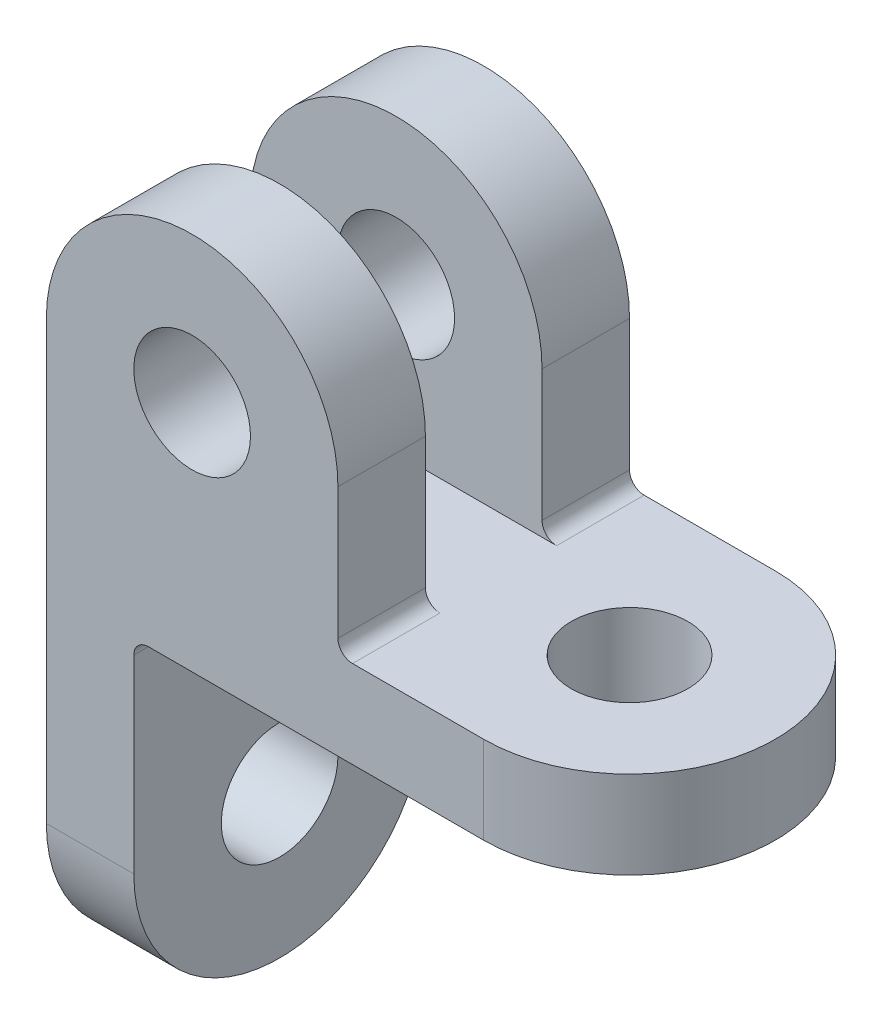
from build123d import *

# Parameters (mm, degrees)
BOSS_EXTRUDE1_DEPTH              = 15
BOSS_EXTRUDE2_START              = 6
SKETCH1_5_R                      = 6
BOSS_EXTRUDE2_DEPTH              = 9
BOSS_EXTRUDE5_START              = -15
SKETCH1_8_R                      = 6
BOSS_EXTRUDE5_DEPTH              = 9
FILLET1_RADIUS                   = 15
FILLET1_LENGTH                   = 9
FILLET2_RADIUS                   = 15
FILLET2_LENGTH                   = 9
F_12_0MM_DOWEL_HOLE1_D           = 12
F_12_0MM_DOWEL_HOLE1_ON_FACE_2_D = 12
FILLET3_R                        = 1.5


with BuildPart() as part:
    # Sketch1 → Boss-Extrude1 (new, symmetric)
    with BuildSketch(Plane.XY):
        Polygon((30, 45), (0, 45), (0, 0), (9, 0), (9, 36), (60, 36), (60, 45), align=None)
    extrude(amount=BOSS_EXTRUDE1_DEPTH, both=True)

    # Sketch1<5> → Boss-Extrude2 (add)
    with BuildSketch(Plane.XY.offset(BOSS_EXTRUDE2_START)):
        with BuildLine():
            ThreePointArc((30, 60), (15, 75), (0, 60))
            Line((0, 60), (0, 45))
            Line((0, 45), (30, 45))
            Line((30, 45), (30, 60))
        make_face()
        with Locations((15, 60)):
            Circle(SKETCH1_5_R, mode=Mode.SUBTRACT)
    extrude(amount=BOSS_EXTRUDE2_DEPTH)

    # Sketch1<8> → Boss-Extrude5 (add)
    with BuildSketch(Plane.XY.offset(BOSS_EXTRUDE5_START)):
        with BuildLine():
            ThreePointArc((30, 60), (15, 75), (0, 60))
            Line((0, 60), (0, 45))
            Line((0, 45), (30, 45))
            Line((30, 45), (30, 60))
        make_face()
        with Locations((15, 60)):
            Circle(SKETCH1_8_R, mode=Mode.SUBTRACT)
    extrude(amount=BOSS_EXTRUDE5_DEPTH)

    # Fillet1: full round fillet: the end face becomes a half cylinder, R = half its width
    fillet1_face = Plane((60, 40.5, 0), x_dir=(0, -1, 0), z_dir=(1, 0, 0))  # on the end face: x along it, z out of the body
    fillet1_slab = fillet1_face.offset(-FILLET1_RADIUS / 2) * Box(FILLET1_LENGTH, 2 * FILLET1_RADIUS, FILLET1_RADIUS, mode=Mode.PRIVATE)  # the body's end, R deep
    fillet1_round = Plane((45, 40.5, 0), x_dir=(1, 0, 0), z_dir=(0, -1, 0)) * Cylinder(FILLET1_RADIUS, FILLET1_LENGTH, mode=Mode.PRIVATE)  # its axis R under the face
    add(fillet1_slab - fillet1_round, mode=Mode.SUBTRACT)

    # Fillet2: full round fillet: the end face becomes a half cylinder, R = half its width
    fillet2_face = Plane((4.5, 0, 0), x_dir=(-1, 0, 0), z_dir=(0, -1, 0))  # on the end face: x along it, z out of the body
    fillet2_slab = fillet2_face.offset(-FILLET2_RADIUS / 2) * Box(FILLET2_LENGTH, 2 * FILLET2_RADIUS, FILLET2_RADIUS, mode=Mode.PRIVATE)  # the body's end, R deep
    fillet2_round = Plane((4.5, 15, 0), x_dir=(0, -1, 0), z_dir=(-1, 0, 0)) * Cylinder(FILLET2_RADIUS, FILLET2_LENGTH, mode=Mode.PRIVATE)  # its axis R under the face
    add(fillet2_slab - fillet2_round, mode=Mode.SUBTRACT)

    # Ø12.0mm Dowel Hole1 (through all)
    with Locations(Plane(origin=(45, 45, 0), x_dir=(1, 0, 0), z_dir=(0, 1, 0))):
        with Locations((0, 0)):
            Hole(F_12_0MM_DOWEL_HOLE1_D / 2)

    # Ø12.0mm Dowel Hole1 on face 2 (through all)
    with Locations(Plane(origin=(9, 15, 0), x_dir=(0, 0, 1), z_dir=(1, 0, 0))):
        with Locations((0, 0)):
            Hole(F_12_0MM_DOWEL_HOLE1_ON_FACE_2_D / 2)

    # Fillet3
    fillet3_edges = [part.edges().sort_by_distance(p)[0] for p in [
        (9, 36, 0),
        (30, 45, 10.5),
        (30, 45, -10.5),
    ]]
    fillet(fillet3_edges, radius=FILLET3_R)


solid = part.part
